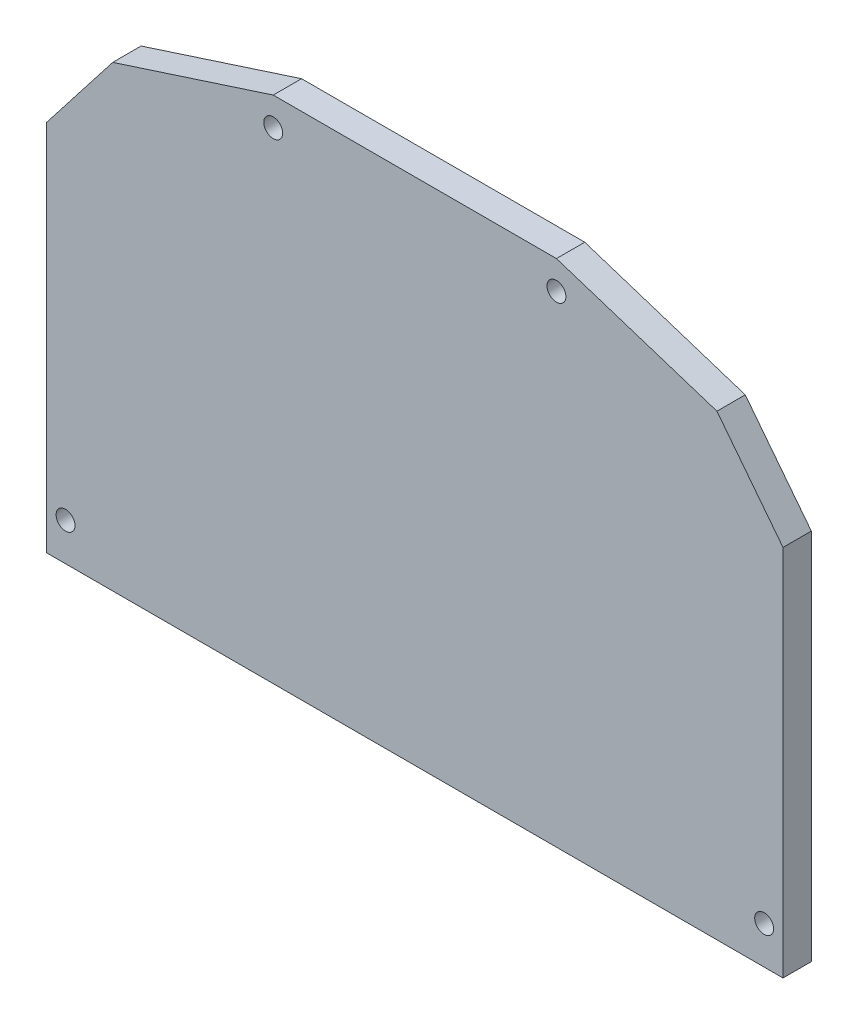
from build123d import *

# Parameters (mm, degrees)
SKETCH_1_R      = 1
EXTRUDE_1_DEPTH = 3


with BuildPart() as part:
    # 草图1 → 凸台-拉伸1 (new body)
    with BuildSketch(Plane.XY):
        Polygon((-8, 125.5), (-15, 134.5), (-32, 140), (-62, 140), (-79, 134.5), (-86, 125.5), (-86, 86), (-8, 86), align=None)
        with Locations((-32, 137)):
            Circle(SKETCH_1_R, mode=Mode.SUBTRACT)
        with Locations((-62, 137)):
            Circle(SKETCH_1_R, mode=Mode.SUBTRACT)
        with Locations((-84, 90)):
            Circle(SKETCH_1_R, mode=Mode.SUBTRACT)
        with Locations((-10, 90)):
            Circle(SKETCH_1_R, mode=Mode.SUBTRACT)
    extrude(amount=EXTRUDE_1_DEPTH)


solid = part.part
